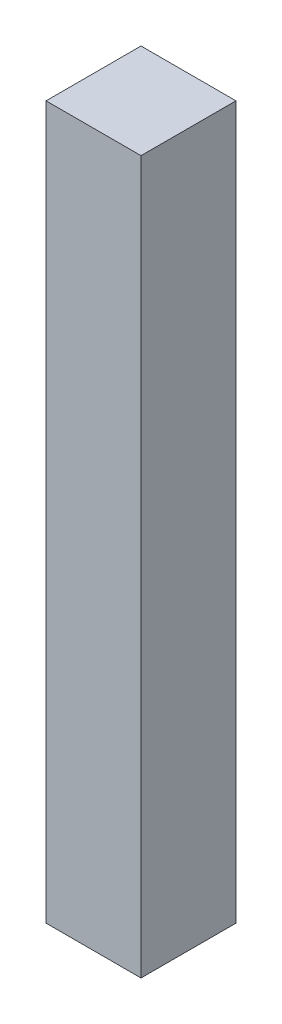
from build123d import *

# Parameters (mm, degrees)
SKETCH1_W      = 20
SKETCH1_H      = 20
EXTRUDE1_DEPTH = 150


with BuildPart() as part:
    # Sketch1 → Extrude1 (new body)
    with BuildSketch(Plane(origin=(0, 0, 0), x_dir=(1, 0, 0), z_dir=(0, 1, 0))):
        Rectangle(SKETCH1_W, SKETCH1_H)
    extrude(amount=EXTRUDE1_DEPTH)


solid = part.part
